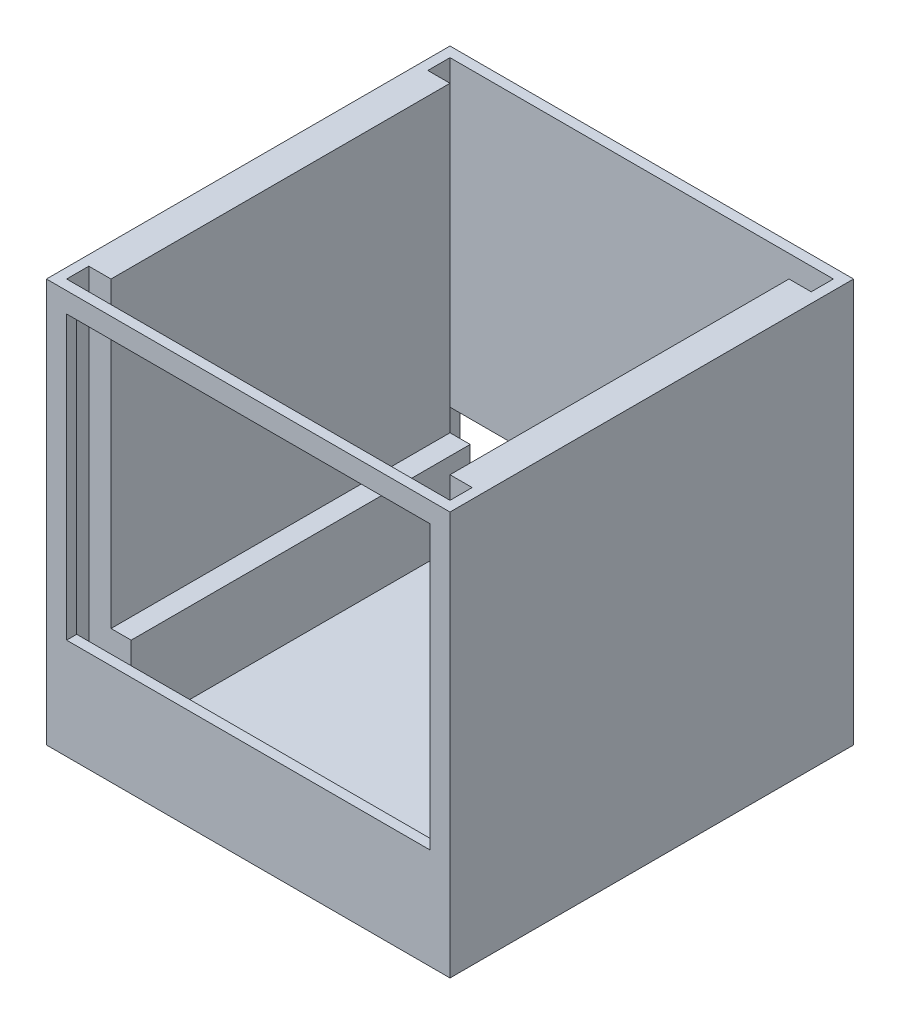
from build123d import *

# Parameters (mm, degrees)
SKETCH1_W           = 254
SKETCH1_H           = 254
BOSS_EXTRUDE1_DEPTH = 190.5
BOSS_EXTRUDE2_DEPTH = 50.8
SKETCH5_W           = 254
SKETCH5_H           = 254
BOSS_EXTRUDE3_DEPTH = 12.7
SKETCH6_W           = 228.6
SKETCH6_H           = 177.8
CUT_EXTRUDE1_DEPTH  = 12.7
SKETCH1_4_W         = 13.97
SKETCH1_4_H         = 213.36
BOSS_EXTRUDE5_DEPTH = 50.8
SKETCH8_W           = 12.7
SKETCH8_H           = 213.36
BOSS_EXTRUDE6_DEPTH = 50.8


with BuildPart() as part:
    # Sketch1 → Boss-Extrude1 (new body)
    with BuildSketch(Plane(origin=(0, 0, 0), x_dir=(1, 0, 0), z_dir=(0, 1, 0))):
        Rectangle(SKETCH1_W, SKETCH1_H)
        Polygon((120.65, -120.65), (-120.65, -120.65), (-120.65, -106.68), (-106.68, -106.68), (-106.68, 106.68), (-120.65, 106.68), (-120.65, 120.65), (120.65, 120.65), (120.65, 106.68), (106.68, 106.68), (106.68, -106.68), (120.65, -106.68), align=None, mode=Mode.SUBTRACT)
    extrude(amount=BOSS_EXTRUDE1_DEPTH)

    # Sketch4 → Boss-Extrude2 (add)
    with BuildSketch(Plane.XZ):
        Polygon((-127, 127), (-127, -127), (-120.65, -127), (-120.65, -120.65), (-120.65, -106.68), (-120.65, 106.68), (-120.65, 120.65), (120.65, 120.65), (120.65, 106.68), (120.65, -106.68), (120.65, -120.65), (120.65, -127), (127, -127), (127, 127), align=None)
    extrude(amount=BOSS_EXTRUDE2_DEPTH)

    # Sketch5 → Boss-Extrude3 (add)
    with BuildSketch(Plane.XZ.offset(50.8)):
        Rectangle(SKETCH5_W, SKETCH5_H)
    extrude(amount=BOSS_EXTRUDE3_DEPTH)

    # Sketch6 → Cut-Extrude1 (cut)
    with BuildSketch(Plane.XY.offset(127)):
        with Locations((0, 88.9)):
            Rectangle(SKETCH6_W, SKETCH6_H)
    extrude(amount=-CUT_EXTRUDE1_DEPTH, mode=Mode.SUBTRACT)

    # Sketch1<4> → Boss-Extrude5 (add)
    with BuildSketch(Plane(origin=(0, 0, 0), x_dir=(1, 0, 0), z_dir=(0, 1, 0))):
        with Locations((-113.665, 0)):
            Rectangle(SKETCH1_4_W, SKETCH1_4_H)
        with Locations((113.665, 0)):
            Rectangle(SKETCH1_4_W, SKETCH1_4_H)
    extrude(amount=-BOSS_EXTRUDE5_DEPTH)

    # Sketch8 → Boss-Extrude6 (add)
    with BuildSketch(Plane(origin=(0, -50.8, 0), x_dir=(1, 0, 0), z_dir=(0, 1, 0))):
        with Locations((-100.33, 0)):
            Rectangle(SKETCH8_W, SKETCH8_H)
        with Locations((100.33, 0)):
            Rectangle(SKETCH8_W, SKETCH8_H)
    extrude(amount=BOSS_EXTRUDE6_DEPTH)


solid = part.part
